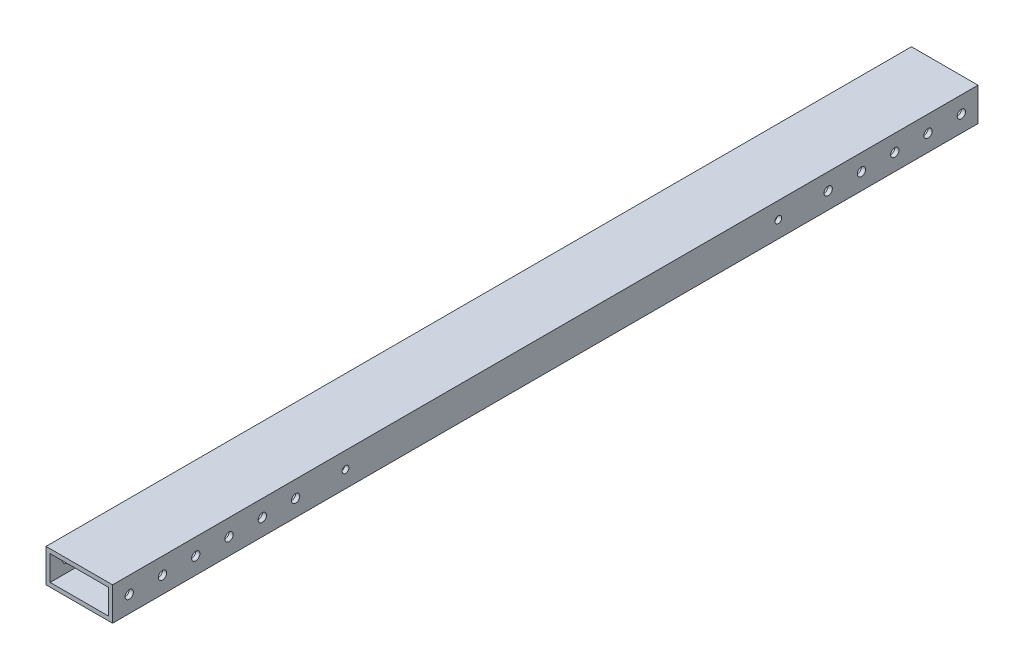
from build123d import *

# Parameters (mm, degrees)
BOSS_EXTRUDE1_DEPTH              = 330.2
BOSS_EXTRUDE1_DEPTH_BACK         = 330.2
SKETCH3_W                        = 50.8
SKETCH3_H                        = 25.4
SKETCH3_W_2                      = 44.45
SKETCH3_H_2                      = 19.05
F_1_4_0_25_DIAMETER_HOLE3_D      = 6.35
F_1_4_0_25_DIAMETER_HOLE4_D      = 6.35
F_1_4_0_25_DIAMETER_HOLE5_D      = 6.35
F_1_4_0_25_DIAMETER_HOLE6_D      = 6.35
F_1_4_0_25_DIAMETER_HOLE7_D      = 6.35
F_1_4_0_25_DIAMETER_HOLE8_D      = 6.35
F_13_64_0_20313_DIAMETER_HOLE1_D = 5.159502
F_1_2_0_5_DIAMETER_HOLE1_D       = 12.7
F_1_2_0_5_DIAMETER_HOLE1_DEPTH   = 6.35
F_1_2_0_5_DIAMETER_HOLE1_TIP     = 3.815464931


with BuildPart() as part:
    # Sketch3 → Boss-Extrude1 (new, two sides: drawn at the far end of the back side and taken through both)
    with BuildSketch(Plane.XY.offset(-BOSS_EXTRUDE1_DEPTH_BACK)):
        Rectangle(SKETCH3_W, SKETCH3_H)
        Rectangle(SKETCH3_W_2, SKETCH3_H_2, mode=Mode.SUBTRACT)
    extrude(amount=BOSS_EXTRUDE1_DEPTH + BOSS_EXTRUDE1_DEPTH_BACK)

    # 1/4 (0.25) Diameter Hole3 (through all)
    with Locations(Plane.ZY.offset(25.4)):
        with Locations((-317.5, 0)):
            Hole(F_1_4_0_25_DIAMETER_HOLE3_D / 2)

    # 1/4 (0.25) Diameter Hole4 (through all)
    with Locations(Plane.ZY.offset(25.4)):
        with Locations((292.1, 0), (317.5, 0)):
            Hole(F_1_4_0_25_DIAMETER_HOLE4_D / 2)

    # 1/4 (0.25) Diameter Hole5 (through all)
    with Locations(Plane(origin=(25.4, 0, 0), x_dir=(0, 0, -1), z_dir=(1, 0, 0))):
        with Locations((292.1, 0), (266.7, 0)):
            Hole(F_1_4_0_25_DIAMETER_HOLE5_D / 2)

    # 1/4 (0.25) Diameter Hole6 (through all)
    with Locations(Plane(origin=(25.4, 0, 0), x_dir=(0, 0, -1), z_dir=(1, 0, 0))):
        with Locations((215.9, 0), (241.3, 0)):
            Hole(F_1_4_0_25_DIAMETER_HOLE6_D / 2)

    # 1/4 (0.25) Diameter Hole7 (through all)
    with Locations(Plane(origin=(25.4, 0, 0), x_dir=(0, 0, -1), z_dir=(1, 0, 0))):
        with Locations((-190.5, 0), (-215.9, 0)):
            Hole(F_1_4_0_25_DIAMETER_HOLE7_D / 2)

    # 1/4 (0.25) Diameter Hole8 (through all)
    with Locations(Plane(origin=(25.4, 0, 0), x_dir=(0, 0, -1), z_dir=(1, 0, 0))):
        with Locations((-266.7, 0), (-241.3, 0)):
            Hole(F_1_4_0_25_DIAMETER_HOLE8_D / 2)

    # 13/64 (0.20313) Diameter Hole1 (through all)
    with Locations(Plane(origin=(25.4, 0, 0), x_dir=(0, 0, -1), z_dir=(1, 0, 0))):
        with Locations((-152.4, 0), (177.8, 0)):
            Hole(F_13_64_0_20313_DIAMETER_HOLE1_D / 2)

    # 1/2 (0.5) Diameter Hole1
    with Locations(Plane.ZY.offset(25.4)):
        with Locations((-146.050000508, 4.9e-08), (120.65, 1.7e-08)):
            Hole(F_1_2_0_5_DIAMETER_HOLE1_D / 2, depth=F_1_2_0_5_DIAMETER_HOLE1_DEPTH)
            with Locations((0, 0, -(F_1_2_0_5_DIAMETER_HOLE1_DEPTH + F_1_2_0_5_DIAMETER_HOLE1_TIP / 2))):  # 118° drill point
                Cone(0, F_1_2_0_5_DIAMETER_HOLE1_D / 2, F_1_2_0_5_DIAMETER_HOLE1_TIP, mode=Mode.SUBTRACT)


solid = part.part
